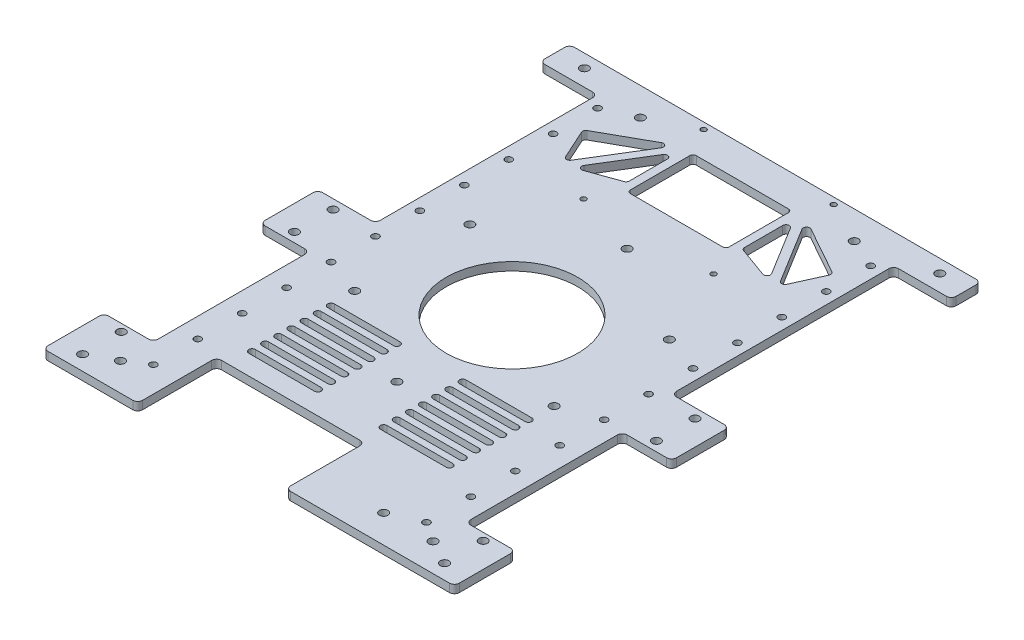
from build123d import *

# Parameters (mm, degrees)
SKETCH_1_W           = 250
SKETCH_1_H           = 320
EXTRUDE_1_DEPTH      = 5
SKETCH_2_R           = 2.6
SKETCH_2_R_2         = 40
CUT_EXTRUDE_1_DEPTH  = 50
SKETCH_3_W           = 35
SKETCH_3_H           = 135
SKETCH_3_W_2         = 30
SKETCH_3_H_2         = 95
CUT_EXTRUDE_2_DEPTH  = 50
FILLET_1_R           = 3
SKETCH_6_R           = 2.6
CUT_EXTRUDE_4_DEPTH  = 100
SKETCH_7_R           = 2.1
CUT_EXTRUDE_5_DEPTH  = 500
SKETCH_8_W           = 90
SKETCH_8_H           = 48
CUT_EXTRUDE_6_DEPTH  = 10
FILLET_2_R           = 3
SKETCH_9_R           = 1.6
CUT_EXTRUDE_7_DEPTH  = 10
SKETCH_10_R          = 2.6
CUT_EXTRUDE_8_DEPTH  = 10
SKETCH_12_R          = 2.6
CUT_EXTRUDE_9_DEPTH  = 10
SKETCH_13_W          = 60
SKETCH_13_H          = 40
CUT_EXTRUDE_10_DEPTH = 10
FILLET_3_R           = 2


with BuildPart() as part:
    # 草图1 → 凸台-拉伸1 (new body)
    with BuildSketch(Plane(origin=(0, 0, 0), x_dir=(1, 0, 0), z_dir=(0, 1, 0))):
        Rectangle(SKETCH_1_W, SKETCH_1_H)
    extrude(amount=EXTRUDE_1_DEPTH)

    # 草图2 → 切除-拉伸1 (cut)
    with BuildSketch(Plane(origin=(0, 5, 0), x_dir=(1, 0, 0), z_dir=(0, 1, 0))):
        with Locations(Location((0, 70, 0), (0, 0, 270))):
            Circle(SKETCH_2_R)
        with Locations(Location((60.621778265, 35, 0), (0, 0, 270))):
            Circle(SKETCH_2_R)
        with Locations(Location((60.621778265, -35, 0), (0, 0, 270))):
            Circle(SKETCH_2_R)
        with Locations(Location((0, -70, 0), (0, 0, 270))):
            Circle(SKETCH_2_R)
        with Locations(Location((-60.621778265, -35, 0), (0, 0, 270))):
            Circle(SKETCH_2_R)
        with Locations(Location((-60.621778265, 35, 0), (0, 0, 270))):
            Circle(SKETCH_2_R)
        with Locations(Location((0, 0, 0), (0, 0, 270))):
            Circle(SKETCH_2_R_2)
    extrude(amount=-CUT_EXTRUDE_1_DEPTH, mode=Mode.SUBTRACT)

    # 草图3 → 切除-拉伸2 (cut)
    with BuildSketch(Plane(origin=(0, 5, 0), x_dir=(1, 0, 0), z_dir=(0, 1, 0))):
        with Locations((-107.5, 74.5)):
            Rectangle(SKETCH_3_W, SKETCH_3_H)
        with Locations((107.5, 74.5)):
            Rectangle(SKETCH_3_W, SKETCH_3_H)
        with Locations((110, -75.5)):
            Rectangle(SKETCH_3_W_2, SKETCH_3_H_2)
        with Locations((-110, -75.5)):
            Rectangle(SKETCH_3_W_2, SKETCH_3_H_2)
    extrude(amount=-CUT_EXTRUDE_2_DEPTH, mode=Mode.SUBTRACT)

    # 圆角1
    fillet_1_edges = [part.edges().sort_by_distance(p)[0] for p in [
        (125, 2.5, -142),
        (125, 2.5, -7),
        (90, 2.5, -7),
        (90, 2.5, -142),
        (-125, 2.5, 123),
        (-125, 2.5, 28),
        (-95, 2.5, 28),
        (-95, 2.5, 123),
        (-125, 2.5, -160),
        (125, 2.5, -160),
        (125, 2.5, 160),
        (-125, 2.5, 160),
        (125, 2.5, 28),
        (125, 2.5, 123),
        (95, 2.5, 123),
        (95, 2.5, 28),
        (-125, 2.5, -7),
        (-125, 2.5, -142),
        (-90, 2.5, -142),
        (-90, 2.5, -7),
    ]]
    fillet(fillet_1_edges, radius=FILLET_1_R)

    # 草图6 → 切除-拉伸4 (cut)
    with BuildSketch(Plane(origin=(0, 5, 0), x_dir=(1, 0, 0), z_dir=(0, 1, 0))):
        with Locations(Location((-110, 1.25, 0), (0, 0, 270))):
            Circle(SKETCH_6_R)
        with Locations(Location((-110, -22.25, 0), (0, 0, 270))):
            Circle(SKETCH_6_R)
        with Locations(Location((110, -22.25, 0), (0, 0, 270))):
            Circle(SKETCH_6_R)
        with Locations(Location((110, 1.25, 0), (0, 0, 270))):
            Circle(SKETCH_6_R)
        with Locations(Location((-110, -127.5, 0), (0, 0, 270))):
            Circle(SKETCH_6_R)
        with Locations(Location((-110, -151, 0), (0, 0, 270))):
            Circle(SKETCH_6_R)
        with Locations(Location((110, -151, 0), (0, 0, 270))):
            Circle(SKETCH_6_R)
        with Locations(Location((110, -127.5, 0), (0, 0, 270))):
            Circle(SKETCH_6_R)
    extrude(amount=-CUT_EXTRUDE_4_DEPTH, mode=Mode.SUBTRACT)

    # 草图7 → 切除-拉伸5 (cut)
    with BuildSketch(Plane(origin=(0, 5, 0), x_dir=(1, 0, 0), z_dir=(0, 1, 0))):
        with Locations(Location((-83, 135, 0), (0, 0, 270))):
            Circle(SKETCH_7_R)
        with Locations(Location((-83, 108, 0), (0, 0, 270))):
            Circle(SKETCH_7_R)
        with Locations(Location((-83, 81, 0), (0, 0, 270))):
            Circle(SKETCH_7_R)
        with Locations(Location((-83, 54, 0), (0, 0, 270))):
            Circle(SKETCH_7_R)
        with Locations(Location((-83, 27, 0), (0, 0, 270))):
            Circle(SKETCH_7_R)
        with Locations(Location((-83, 0, 0), (0, 0, 270))):
            Circle(SKETCH_7_R)
        with Locations(Location((-83, -27, 0), (0, 0, 270))):
            Circle(SKETCH_7_R)
        with Locations(Location((-83, -54, 0), (0, 0, 270))):
            Circle(SKETCH_7_R)
        with Locations(Location((-83, -81, 0), (0, 0, 270))):
            Circle(SKETCH_7_R)
        with Locations(Location((-83, -108, 0), (0, 0, 270))):
            Circle(SKETCH_7_R)
        with Locations(Location((-83, -135, 0), (0, 0, 270))):
            Circle(SKETCH_7_R)
        with Locations(Location((83, -135, 0), (0, 0, 270))):
            Circle(SKETCH_7_R)
        with Locations(Location((83, -108, 0), (0, 0, 270))):
            Circle(SKETCH_7_R)
        with Locations(Location((83, -81, 0), (0, 0, 270))):
            Circle(SKETCH_7_R)
        with Locations(Location((83, -54, 0), (0, 0, 270))):
            Circle(SKETCH_7_R)
        with Locations(Location((83, -27, 0), (0, 0, 270))):
            Circle(SKETCH_7_R)
        with Locations(Location((83, 0, 0), (0, 0, 270))):
            Circle(SKETCH_7_R)
        with Locations(Location((83, 27, 0), (0, 0, 270))):
            Circle(SKETCH_7_R)
        with Locations(Location((83, 54, 0), (0, 0, 270))):
            Circle(SKETCH_7_R)
        with Locations(Location((83, 81, 0), (0, 0, 270))):
            Circle(SKETCH_7_R)
        with Locations(Location((83, 108, 0), (0, 0, 270))):
            Circle(SKETCH_7_R)
        with Locations(Location((83, 135, 0), (0, 0, 270))):
            Circle(SKETCH_7_R)
    extrude(amount=-CUT_EXTRUDE_5_DEPTH, mode=Mode.SUBTRACT)

    # 草图8 → 切除-拉伸6 (cut)
    with BuildSketch(Plane(origin=(0, 0, 0), x_dir=(-1, 0, 0), z_dir=(0, -1, 0))):
        with Locations((22.5, -136)):
            Rectangle(SKETCH_8_W, SKETCH_8_H)
    extrude(amount=-CUT_EXTRUDE_6_DEPTH, mode=Mode.SUBTRACT)

    # 圆角2
    fillet_2_edges = [part.edges().sort_by_distance(p)[0] for p in [
        (22.5, 2.5, 160),
        (22.5, 2.5, 112),
        (-67.5, 2.5, 112),
        (-67.5, 2.5, 160),
    ]]
    fillet(fillet_2_edges, radius=FILLET_2_R)

    # 草图9 → 切除-拉伸7 (cut)
    with BuildSketch(Plane(origin=(0, 5, 0), x_dir=(1, 0, 0), z_dir=(0, 1, 0))):
        with Locations(Location((-39.5, 156, 0), (0, 0, 270))):
            Circle(SKETCH_9_R)
        with Locations(Location((39.5, 156, 0), (0, 0, 270))):
            Circle(SKETCH_9_R)
        with Locations(Location((39.5, 83, 0), (0, 0, 270))):
            Circle(SKETCH_9_R)
        with Locations(Location((-39.5, 83, 0), (0, 0, 270))):
            Circle(SKETCH_9_R)
    extrude(amount=-CUT_EXTRUDE_7_DEPTH, mode=Mode.SUBTRACT)

    # 草图10 → 切除-拉伸8 (cut)
    with BuildSketch(Plane(origin=(0, 5, 0), x_dir=(1, 0, 0), z_dir=(0, 1, 0))):
        with Locations(Location((-108, 152, 0), (0, 0, 270))):
            Circle(SKETCH_10_R)
        with Locations(Location((108, 152, 0), (0, 0, 270))):
            Circle(SKETCH_10_R)
        with Locations(Location((-95, -143, 0), (0, 0, 270))):
            Circle(SKETCH_10_R)
        with Locations(Location((95, -143, 0), (0, 0, 270))):
            Circle(SKETCH_10_R)
    extrude(amount=-CUT_EXTRUDE_8_DEPTH, mode=Mode.SUBTRACT)

    # 草图12 → 切除-拉伸9 (cut)
    with BuildSketch(Plane(origin=(0, 5, 0), x_dir=(1, 0, 0), z_dir=(0, 1, 0))):
        with Locations(Location((65, 143, 0), (0, 0, 270))):
            Circle(SKETCH_12_R)
        with Locations(Location((65, -143, 0), (0, 0, 270))):
            Circle(SKETCH_12_R)
        with Locations(Location((-65, 143, 0), (0, 0, 270))):
            Circle(SKETCH_12_R)
    extrude(amount=-CUT_EXTRUDE_9_DEPTH, mode=Mode.SUBTRACT)

    # 草图13 → 切除-拉伸10 (cut)
    with BuildSketch(Plane(origin=(0, 5, 0), x_dir=(1, 0, 0), z_dir=(0, 1, 0))):
        with Locations((0, 120)):
            Rectangle(SKETCH_13_W, SKETCH_13_H)
        Polygon((35, 136.572577308), (35, 104.90019159), (60, 95.925020983), align=None)
        Polygon((38.761991594, 140), (65.628366053, 96.317901238), (76, 119.177580738), align=None)
        Polygon((-65.628366053, 96.317901238), (-76, 119.177580738), (-38.761991594, 140), align=None)
        Polygon((-35, 104.90019159), (-60, 95.925020983), (-35, 136.572577308), align=None)
        with BuildLine():
            Line((-60, -48), (-20, -48))
            ThreePointArc((-20, -48), (-18, -50), (-20, -52))
            Line((-20, -52), (-60, -52))
            ThreePointArc((-60, -52), (-62, -50), (-60, -48))
        make_face()
        with BuildLine():
            Line((-60, -56), (-20, -56))
            ThreePointArc((-20, -56), (-18, -58), (-20, -60))
            Line((-20, -60), (-60, -60))
            ThreePointArc((-60, -60), (-62, -58), (-60, -56))
        make_face()
        with BuildLine():
            Line((-60, -64), (-20, -64))
            ThreePointArc((-20, -64), (-18, -66), (-20, -68))
            Line((-20, -68), (-60, -68))
            ThreePointArc((-60, -68), (-62, -66), (-60, -64))
        make_face()
        with BuildLine():
            Line((-60, -72), (-20, -72))
            ThreePointArc((-20, -72), (-18, -74), (-20, -76))
            Line((-20, -76), (-60, -76))
            ThreePointArc((-60, -76), (-62, -74), (-60, -72))
        make_face()
        with BuildLine():
            Line((-60, -80), (-20, -80))
            ThreePointArc((-20, -80), (-18, -82), (-20, -84))
            Line((-20, -84), (-60, -84))
            ThreePointArc((-60, -84), (-62, -82), (-60, -80))
        make_face()
        with BuildLine():
            Line((-60, -88), (-20, -88))
            ThreePointArc((-20, -88), (-18, -90), (-20, -92))
            Line((-20, -92), (-60, -92))
            ThreePointArc((-60, -92), (-62, -90), (-60, -88))
        make_face()
        with BuildLine():
            Line((60, -88), (20, -88))
            ThreePointArc((20, -88), (18, -90), (20, -92))
            Line((20, -92), (60, -92))
            ThreePointArc((60, -92), (62, -90), (60, -88))
        make_face()
        with BuildLine():
            Line((60, -80), (20, -80))
            ThreePointArc((20, -80), (18, -82), (20, -84))
            Line((20, -84), (60, -84))
            ThreePointArc((60, -84), (62, -82), (60, -80))
        make_face()
        with BuildLine():
            Line((60, -72), (20, -72))
            ThreePointArc((20, -72), (18, -74), (20, -76))
            Line((20, -76), (60, -76))
            ThreePointArc((60, -76), (62, -74), (60, -72))
        make_face()
        with BuildLine():
            Line((60, -64), (20, -64))
            ThreePointArc((20, -64), (18, -66), (20, -68))
            Line((20, -68), (60, -68))
            ThreePointArc((60, -68), (62, -66), (60, -64))
        make_face()
        with BuildLine():
            Line((60, -56), (20, -56))
            ThreePointArc((20, -56), (18, -58), (20, -60))
            Line((20, -60), (60, -60))
            ThreePointArc((60, -60), (62, -58), (60, -56))
        make_face()
        with BuildLine():
            Line((60, -48), (20, -48))
            ThreePointArc((20, -48), (18, -50), (20, -52))
            Line((20, -52), (60, -52))
            ThreePointArc((60, -52), (62, -50), (60, -48))
        make_face()
        with BuildLine():
            Line((-60, -96), (-20, -96))
            ThreePointArc((-20, -96), (-18, -98), (-20, -100))
            Line((-20, -100), (-60, -100))
            ThreePointArc((-60, -100), (-62, -98), (-60, -96))
        make_face()
        with BuildLine():
            Line((60, -96), (20, -96))
            ThreePointArc((20, -96), (18, -98), (20, -100))
            Line((20, -100), (60, -100))
            ThreePointArc((60, -100), (62, -98), (60, -96))
        make_face()
    extrude(amount=-CUT_EXTRUDE_10_DEPTH, mode=Mode.SUBTRACT)

    # 圆角3
    fillet_3_edges = [part.edges().sort_by_distance(p)[0] for p in [
        (38.761991594, 2.5, -140),
        (76, 2.5, -119.177580738),
        (65.628366053, 2.5, -96.317901238),
        (35, 2.5, -136.572577308),
        (60, 2.5, -95.925020983),
        (35, 2.5, -104.90019159),
        (-35, 2.5, -136.572577308),
        (-35, 2.5, -104.90019159),
        (-60, 2.5, -95.925020983),
        (-38.761991594, 2.5, -140),
        (-65.628366053, 2.5, -96.317901238),
        (-76, 2.5, -119.177580738),
        (-30, 2.5, -100),
        (-30, 2.5, -140),
        (30, 2.5, -140),
        (30, 2.5, -100),
    ]]
    fillet(fillet_3_edges, radius=FILLET_3_R)


solid = part.part
